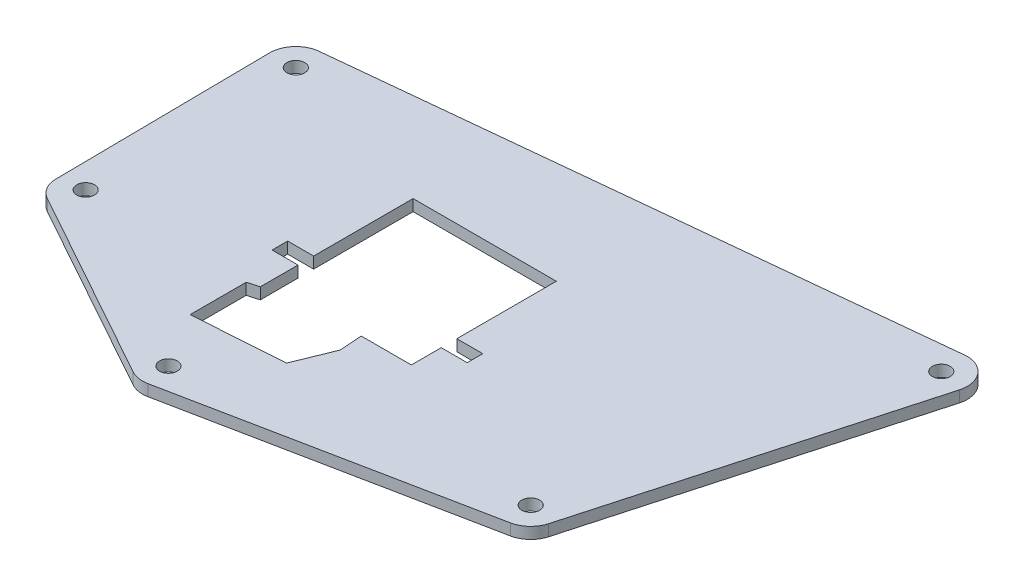
from build123d import *

# Parameters (mm, degrees)
SKETCH1_R            = 2.4892
BOSS_EXTRUDE1_DEPTH  = 3.175
TRIGGER_CUTOUT_DEPTH = 3.175
SERVO_CUTOUT_DEPTH   = 3.175


with BuildPart() as part:
    # Sketch1 → Boss-Extrude1 (new body)
    with BuildSketch(Plane(origin=(0, 0, 0), x_dir=(1, 0, 0), z_dir=(0, 1, 0))):
        with BuildLine():
            Line((-6.8229868, -7.488197853), (47.14701474, -37.472309865))
            ThreePointArc((47.14701474, -37.472309865), (49.553689318, -38.298669515), (52.097667916, -38.242761734))
            Line((52.097667916, -38.242761734), (136.359344262, -21.308190288))
            ThreePointArc((136.359344262, -21.308190288), (139.866879533, -19.510833837), (141.916296901, -16.144354617))
            Line((141.916296901, -16.144354617), (166.90343399, 73.568749369))
            ThreePointArc((166.90343399, 73.568749369), (165.462253091, 80.188248266), (159.182077212, 82.728751949))
            Line((159.182077212, 82.728751949), (-4.366145722, 66.053653766))
            ThreePointArc((-4.366145722, 66.053653766), (-9.125920254, 63.663982971), (-10.969503308, 58.667265887))
            Line((-10.969503308, 58.667265887), (-10.288924124, -1.672992978))
            ThreePointArc((-10.288924124, -1.672992978), (-9.33910622, -5.047363397), (-6.8229868, -7.488197853))
        make_face()
        with Locations(Location((159.917634832, 75.514453101, 0), (0, 0, 270))):
            Circle(SKETCH1_R, mode=Mode.SUBTRACT)
        with Locations(Location((134.930497743, -14.198650885, 0), (0, 0, 270))):
            Circle(SKETCH1_R, mode=Mode.SUBTRACT)
        with Locations(Location((50.668821397, -31.133222331, 0), (0, 0, 270))):
            Circle(SKETCH1_R, mode=Mode.SUBTRACT)
        with Locations(Location((-3.719648143, 58.830829265, 0), (0, 0, 270))):
            Circle(SKETCH1_R, mode=Mode.SUBTRACT)
        with Locations(Location((-3.508126319, -0.086017173, 0), (0, 0, 270))):
            Circle(SKETCH1_R, mode=Mode.SUBTRACT)
    extrude(amount=BOSS_EXTRUDE1_DEPTH)

    # Sketch3 → trigger cutout (cut)
    with BuildSketch(Plane(origin=(0, 3.175, 0), x_dir=(1, 0, 0), z_dir=(0, 1, 0))):
        Polygon((41.255934536, -15.678441329), (66.468104622, -13.883980824), (70.774809833, -3.296663849), (70.032795293, 7.128640439), (58.56546888, 6.312460623), (53.862019579, 3.583115238), (41.255934536, 0), align=None)
    extrude(amount=-TRIGGER_CUTOUT_DEPTH, mode=Mode.SUBTRACT)

    # Sketch4 → servo cutout (cut)
    with BuildSketch(Plane(origin=(0, 3.175, 0), x_dir=(1, 0, 0), z_dir=(0, 1, 0))):
        Polygon((44.328297275, 43.5580507), (84.328297275, 43.5580507), (84.328297275, 15.7580507), (91.578297275, 15.7580507), (91.578297275, 11.409751948), (84.328297275, 11.409751948), (84.328297275, 3.0580507), (64.328297275, 3.0580507), (64.328297275, -2.168421287), (44.328297275, -2.168421287), (44.328297275, 3.0580507), (44.328297275, 11.409751948), (37.078297275, 11.409751948), (37.078297275, 15.7580507), (44.328297275, 15.7580507), align=None)
    extrude(amount=-SERVO_CUTOUT_DEPTH, mode=Mode.SUBTRACT)


solid = part.part
